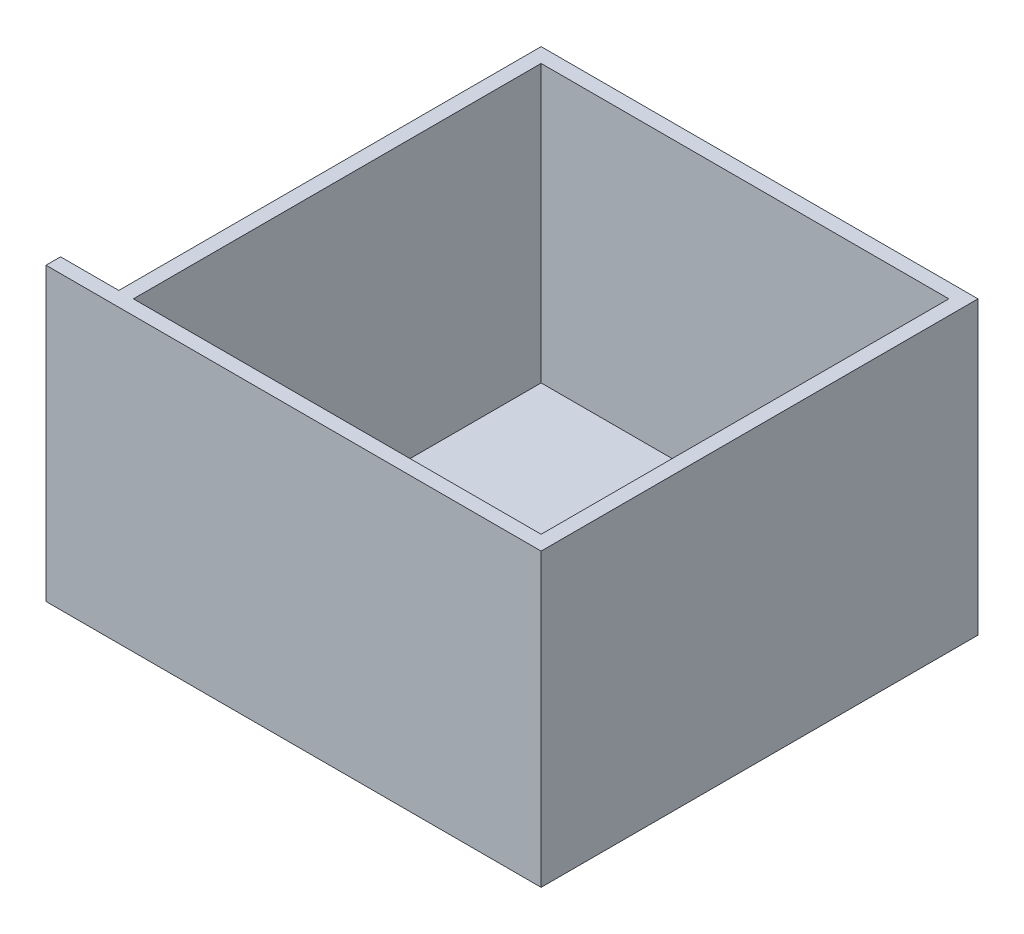
from build123d import *

# Parameters (mm, degrees)
SKETCH1_W           = 15
SKETCH1_H           = 15
BOSS_EXTRUDE1_DEPTH = 10
SHELL6_T            = -0.5
BOSS_EXTRUDE3_DEPTH = 2


with BuildPart() as part:
    # Sketch1 → Boss-Extrude1 (new body)
    with BuildSketch(Plane(origin=(0, 0, 0), x_dir=(1, 0, 0), z_dir=(0, 1, 0))):
        Rectangle(SKETCH1_W, SKETCH1_H)
    extrude(amount=BOSS_EXTRUDE1_DEPTH)

    # Shell6
    shell6_openings = [part.faces().sort_by_distance(p)[0] for p in [
        (0, 10, 0),
    ]]
    offset(amount=SHELL6_T, openings=shell6_openings, kind=Kind.INTERSECTION)

    # Sketch2 → Boss-Extrude3 (add)
    with BuildSketch(Plane.ZY.offset(7.5)):
        Polygon((-7.5, 0), (7.5, 0), (7.5, 0.5), (7.5, 10), (7, 10), (6.9, 0.5), (6.680102085, 0.5), (6.345384733, 1.309388279), (6, 0.5), (5.780102085, 0.5), (5.445384733, 1.309388279), (5.1, 0.5), (4.880102085, 0.5), (4.545384733, 1.309388279), (4.2, 0.5), (3.980102085, 0.5), (3.645384733, 1.309388279), (3.3, 0.5), (3.080102085, 0.5), (2.745384733, 1.309388279), (2.4, 0.5), (2.180102085, 0.5), (1.845384733, 1.309388279), (1.5, 0.5), (1.280102085, 0.5), (0.945384733, 1.309388279), (0.6, 0.5), (0.380102085, 0.5), (0.045384733, 1.309388279), (-0.3, 0.5), (-0.519897915, 0.5), (-0.854615267, 1.309388279), (-1.2, 0.5), (-1.419897915, 0.5), (-1.754615267, 1.309388279), (-2.1, 0.5), (-2.319897915, 0.5), (-2.654615267, 1.309388279), (-3, 0.5), (-3.219897915, 0.5), (-3.554615267, 1.309388279), (-3.9, 0.5), (-4.119897915, 0.5), (-4.454615267, 1.309388279), (-4.8, 0.5), (-5.019897915, 0.5), (-5.354615267, 1.309388279), (-5.7, 0.5), (-5.919897915, 0.5), (-6.254615267, 1.309388279), (-6.6, 0.5), (-6.819897915, 0.5), (-7.154615267, 1.309388279), (-7.5, 0.5), align=None)
    extrude(amount=BOSS_EXTRUDE3_DEPTH)


solid = part.part
